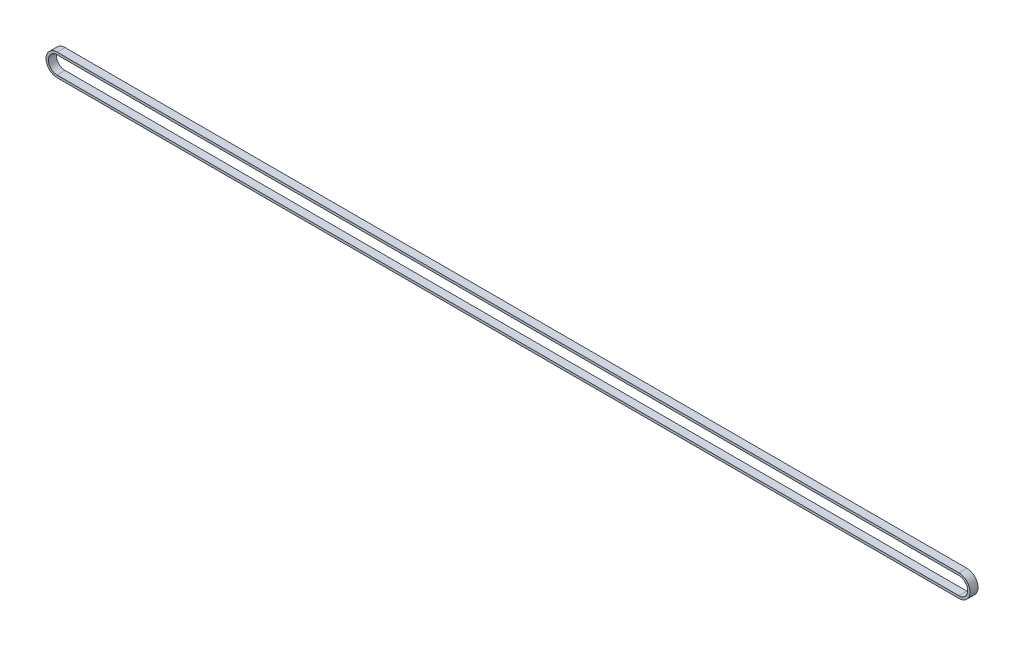
from build123d import *

# Parameters (mm, degrees)
BOSS_EXTRU_1_DEPTH      = 2.5
BOSS_EXTRU_1_DEPTH_BACK = 2.5


with BuildPart() as part:
    # Esquisse1 → Boss.-Extru.1 (new, two sides: drawn at the far end of the back side and taken through both)
    with BuildSketch(Plane.XY.offset(-BOSS_EXTRU_1_DEPTH_BACK)):
        with BuildLine():
            Line((284, -7), (-284, -7))
            ThreePointArc((-284, -7), (-291, 0), (-284, 7))
            Line((-284, 7), (284, 7))
            ThreePointArc((284, 7), (291, 0), (284, -7))
        make_face()
        with BuildLine():
            Line((-284, 5.5), (284, 5.5))
            ThreePointArc((284, 5.5), (289.5, 0), (284, -5.5))
            Line((284, -5.5), (-284, -5.5))
            ThreePointArc((-284, -5.5), (-289.5, 0), (-284, 5.5))
        make_face(mode=Mode.SUBTRACT)
    extrude(amount=BOSS_EXTRU_1_DEPTH + BOSS_EXTRU_1_DEPTH_BACK)


solid = part.part
